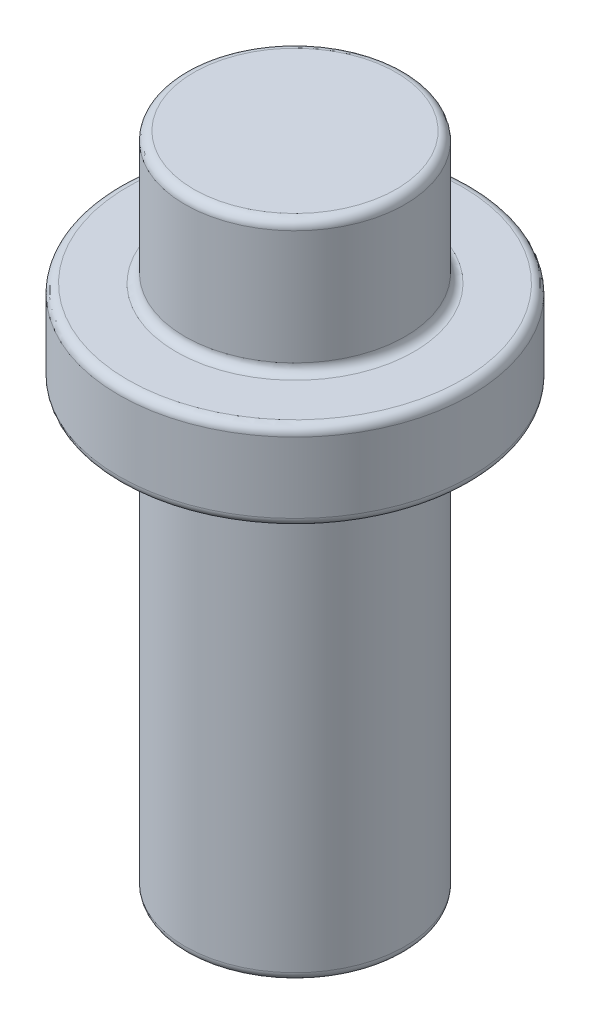
from build123d import *

# Parameters (mm, degrees)
SKETCH1_R           = 2.5
BOSS_EXTRUDE1_DEPTH = 15
SKETCH2_R           = 4
BOSS_EXTRUDE2_DEPTH = 2
FILLET1_R           = 0.2


with BuildPart() as part:
    # Sketch1 → Boss-Extrude1 (new body)
    with BuildSketch(Plane(origin=(0, 0, 0), x_dir=(1, 0, 0), z_dir=(0, 1, 0))):
        with Locations(Location((0, 0, 0), (0, 0, 270))):
            Circle(SKETCH1_R)
    extrude(amount=BOSS_EXTRUDE1_DEPTH)

    # Sketch2 → Boss-Extrude2 (add)
    with BuildSketch(Plane(origin=(0, 10, 0), x_dir=(1, 0, 0), z_dir=(0, 1, 0))):
        with Locations(Location((0, 0, 0), (0, 0, 270))):
            Circle(SKETCH2_R)
    extrude(amount=BOSS_EXTRUDE2_DEPTH)

    # Fillet1
    fillet1_edges = [part.edges().sort_by_distance(p)[0] for p in [
        (0, 0, -2.5),
        (0, 15, -2.5),
        (0, 10, -2.5),
        (0, 12, -2.5),
        (0, 10, -4),
        (0, 12, -4),
    ]]
    fillet(fillet1_edges, radius=FILLET1_R)


solid = part.part
